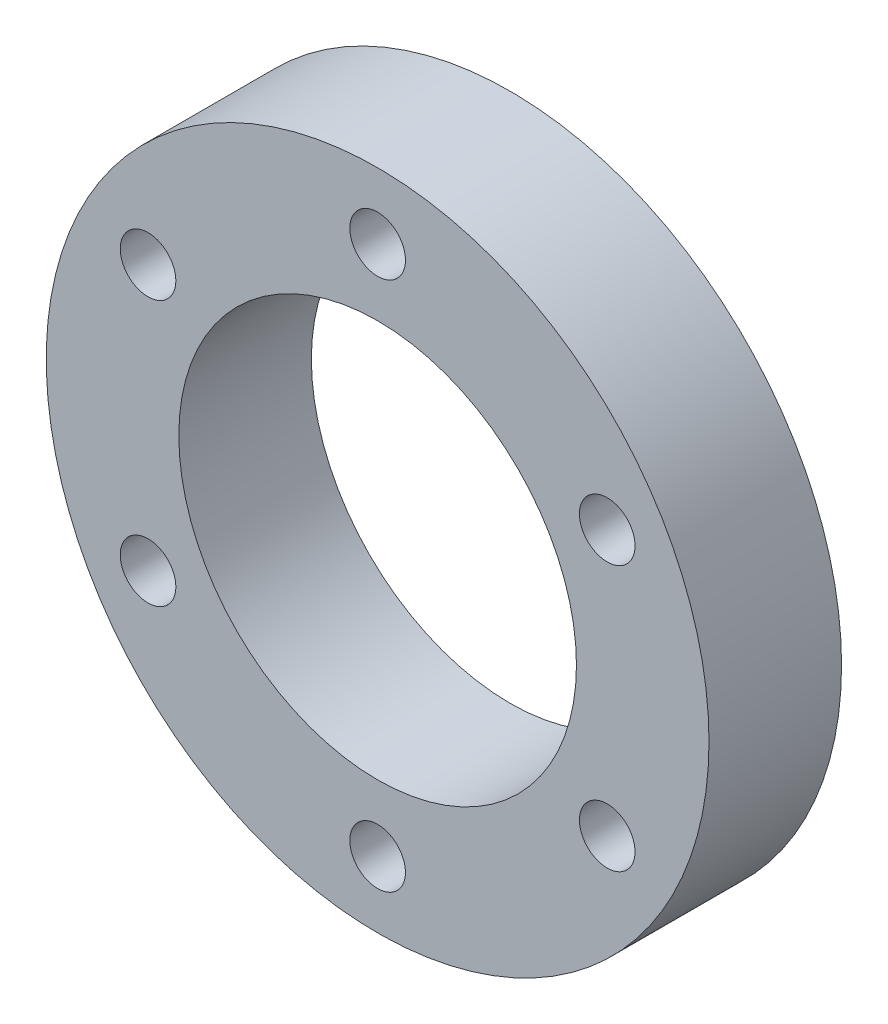
from build123d import *

# Parameters (mm, degrees)
SKETCH1_R           = 31.75
SKETCH1_R_2         = 19.05
BOSS_EXTRUDE1_DEPTH = 12.7
CUT_EXTRUDE1_REACH  = 48.663
SKETCH2_R           = 2.665


with BuildPart() as part:
    # Sketch1 → Boss-Extrude1 (new body)
    with BuildSketch(Plane.XY):
        Circle(SKETCH1_R)
        Circle(SKETCH1_R_2, mode=Mode.SUBTRACT)
    extrude(amount=BOSS_EXTRUDE1_DEPTH)

    # Sketch2 → Cut-Extrude1 (cut, up to next)
    with BuildSketch(Plane.XY.offset(12.7), mode=Mode.PRIVATE) as cut_extrude1_sk1:
        with Locations((0, 25.4)):
            Circle(SKETCH2_R)
    cut_extrude1_tool1 = extrude(cut_extrude1_sk1.sketch, amount=-CUT_EXTRUDE1_REACH, mode=Mode.PRIVATE) & part.part
    # Sketch2 → Cut-Extrude1 (cut, up to next)
    with BuildSketch(Plane.XY.offset(12.7), mode=Mode.PRIVATE) as cut_extrude1_sk2:
        with Locations((21.997045256, 12.7)):
            Circle(SKETCH2_R)
    cut_extrude1_tool2 = extrude(cut_extrude1_sk2.sketch, amount=-CUT_EXTRUDE1_REACH, mode=Mode.PRIVATE) & part.part
    # Sketch2 → Cut-Extrude1 (cut, up to next)
    with BuildSketch(Plane.XY.offset(12.7), mode=Mode.PRIVATE) as cut_extrude1_sk3:
        with Locations((21.997045256, -12.7)):
            Circle(SKETCH2_R)
    cut_extrude1_tool3 = extrude(cut_extrude1_sk3.sketch, amount=-CUT_EXTRUDE1_REACH, mode=Mode.PRIVATE) & part.part
    # Sketch2 → Cut-Extrude1 (cut, up to next)
    with BuildSketch(Plane.XY.offset(12.7), mode=Mode.PRIVATE) as cut_extrude1_sk4:
        with Locations((0, -25.4)):
            Circle(SKETCH2_R)
    cut_extrude1_tool4 = extrude(cut_extrude1_sk4.sketch, amount=-CUT_EXTRUDE1_REACH, mode=Mode.PRIVATE) & part.part
    # Sketch2 → Cut-Extrude1 (cut, up to next)
    with BuildSketch(Plane.XY.offset(12.7), mode=Mode.PRIVATE) as cut_extrude1_sk5:
        with Locations((-21.997045256, -12.7)):
            Circle(SKETCH2_R)
    cut_extrude1_tool5 = extrude(cut_extrude1_sk5.sketch, amount=-CUT_EXTRUDE1_REACH, mode=Mode.PRIVATE) & part.part
    # Sketch2 → Cut-Extrude1 (cut, up to next)
    with BuildSketch(Plane.XY.offset(12.7), mode=Mode.PRIVATE) as cut_extrude1_sk6:
        with Locations((-21.997045256, 12.7)):
            Circle(SKETCH2_R)
    cut_extrude1_tool6 = extrude(cut_extrude1_sk6.sketch, amount=-CUT_EXTRUDE1_REACH, mode=Mode.PRIVATE) & part.part
    add(cut_extrude1_tool1.solids().sort_by_distance((0, 25.4, 12.7))[0], mode=Mode.SUBTRACT)
    add(cut_extrude1_tool2.solids().sort_by_distance((21.997045, 12.7, 12.7))[0], mode=Mode.SUBTRACT)
    add(cut_extrude1_tool3.solids().sort_by_distance((21.997045, -12.7, 12.7))[0], mode=Mode.SUBTRACT)
    add(cut_extrude1_tool4.solids().sort_by_distance((0, -25.4, 12.7))[0], mode=Mode.SUBTRACT)
    add(cut_extrude1_tool5.solids().sort_by_distance((-21.997045, -12.7, 12.7))[0], mode=Mode.SUBTRACT)
    add(cut_extrude1_tool6.solids().sort_by_distance((-21.997045, 12.7, 12.7))[0], mode=Mode.SUBTRACT)


solid = part.part
